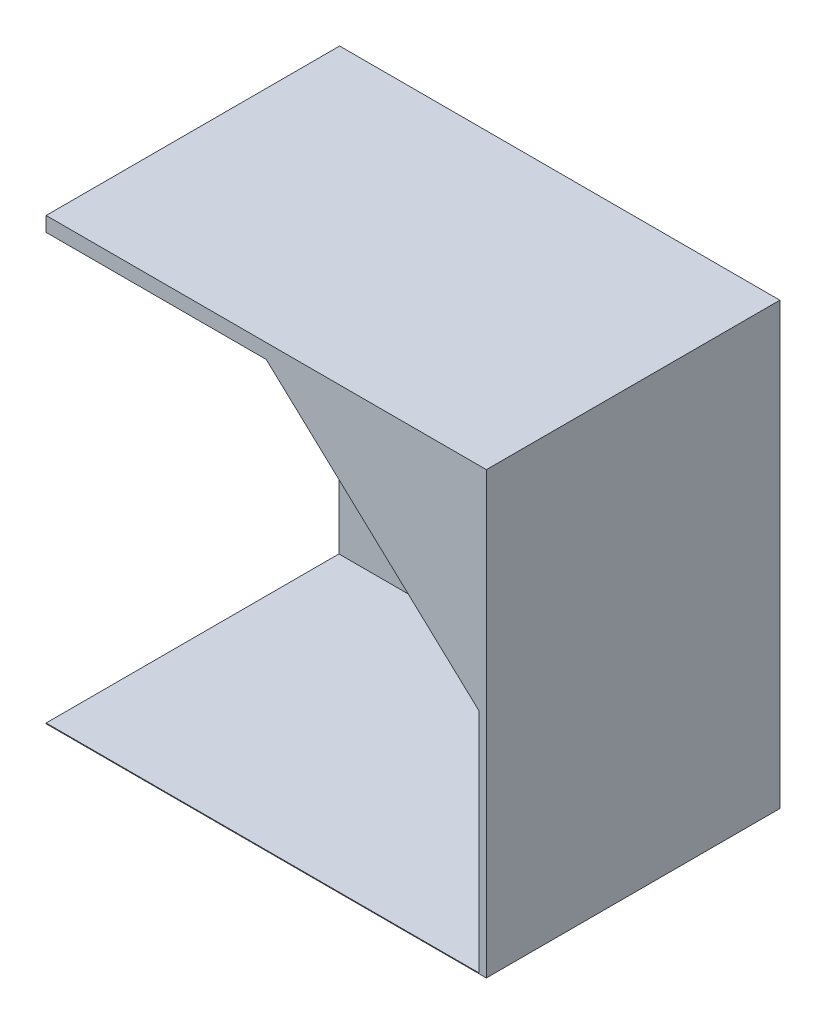
from build123d import *

# Parameters (mm, degrees)
SKETCH1_W               = 3000
SKETCH1_H               = 3000
BOSS_EXTRUDE1_DEPTH     = 2000
CUT_EXTRUDE4_DEPTH      = 2916.475947423
CUT_EXTRUDE4_DEPTH_BACK = 1995
SKETCH3_R               = 100
CUT_EXTRUDE5_DEPTH      = 20


with BuildPart() as part:
    # Sketch1 → Boss-Extrude1 (new body)
    with BuildSketch(Plane.XY):
        Rectangle(SKETCH1_W, SKETCH1_H)
    extrude(amount=BOSS_EXTRUDE1_DEPTH)

    # Sketch2 → Cut-Extrude4 (cut, two sides: drawn at the far end of the back side and taken through both)
    with BuildSketch(Plane.XY.offset(2000).offset(-CUT_EXTRUDE4_DEPTH_BACK)):
        Polygon((0, 1400), (-1500, 1400), (-1500, -1495), (-950, -1495), (1450, -1495), (1450, 51.232739989), align=None)
    extrude(amount=CUT_EXTRUDE4_DEPTH + CUT_EXTRUDE4_DEPTH_BACK, mode=Mode.SUBTRACT)

    # Sketch3 → Cut-Extrude5 (cut)
    with BuildSketch(Plane(origin=(698.170768667, 750.572500224, 0), x_dir=(0.7322043529273712, -0.6810850061146625, 0), z_dir=(-0.6810850061146625, -0.7322043529273712, 0))):
        with Locations((36.641726078, 1500)):
            Circle(SKETCH3_R)
        with Locations((36.641726078, 1002.5)):
            Circle(SKETCH3_R)
        with Locations((36.641726078, 500)):
            Circle(SKETCH3_R)
    extrude(amount=-CUT_EXTRUDE5_DEPTH, mode=Mode.SUBTRACT)


solid = part.part
